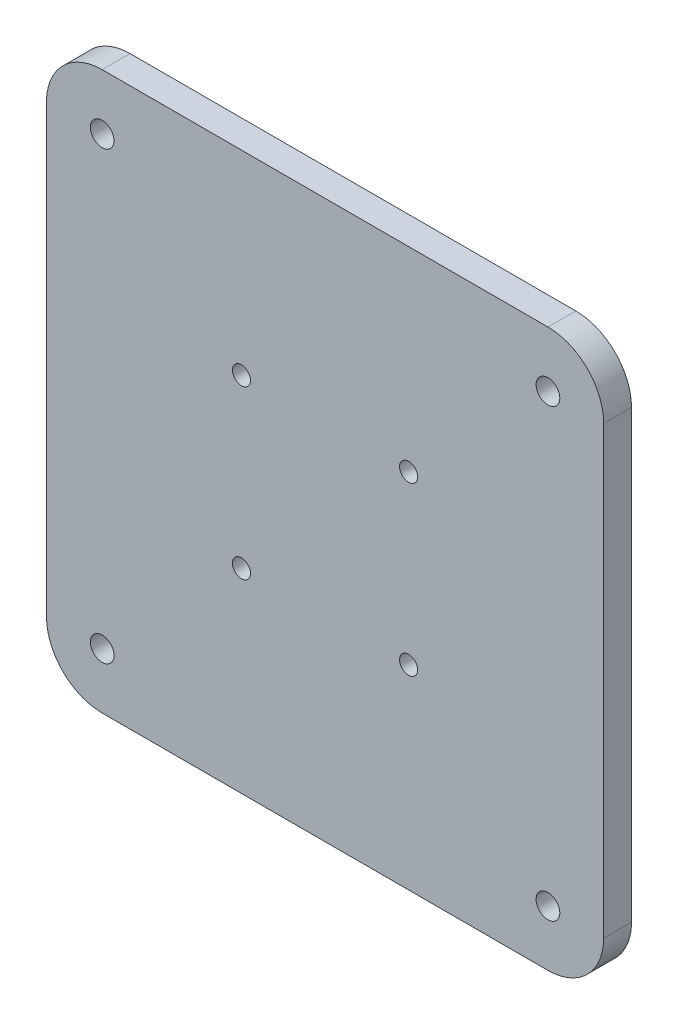
from build123d import *

# Parameters (mm, degrees)
SKETCH_1_W      = 200
SKETCH_1_H      = 200
SKETCH_1_R      = 3.25
SKETCH_1_R_2    = 4.25
EXTRUDE_1_DEPTH = 10
FILLET_1_R      = 20


with BuildPart() as part:
    # 草图1 → 凸台-拉伸1 (new body)
    with BuildSketch(Plane.XY):
        Rectangle(SKETCH_1_W, SKETCH_1_H)
        with Locations((30, 30)):
            Circle(SKETCH_1_R, mode=Mode.SUBTRACT)
        with Locations(Location((30, -30, 0), (0, 0, 180))):
            Circle(SKETCH_1_R, mode=Mode.SUBTRACT)
        with Locations(Location((-30, 30, 0), (0, 0, 180))):
            Circle(SKETCH_1_R, mode=Mode.SUBTRACT)
        with Locations((-30, -30)):
            Circle(SKETCH_1_R, mode=Mode.SUBTRACT)
        with Locations((80, 80)):
            Circle(SKETCH_1_R_2, mode=Mode.SUBTRACT)
        with Locations(Location((80, -80, 0), (0, 0, 180))):
            Circle(SKETCH_1_R_2, mode=Mode.SUBTRACT)
        with Locations((-80, -80)):
            Circle(SKETCH_1_R_2, mode=Mode.SUBTRACT)
        with Locations(Location((-80, 80, 0), (0, 0, 180))):
            Circle(SKETCH_1_R_2, mode=Mode.SUBTRACT)
    extrude(amount=EXTRUDE_1_DEPTH)

    # 圆角1
    fillet_1_edges = [part.edges().sort_by_distance(p)[0] for p in [
        (-100, 100, 5),
        (-100, -100, 5),
        (100, -100, 5),
        (100, 100, 5),
    ]]
    fillet(fillet_1_edges, radius=FILLET_1_R)


solid = part.part
